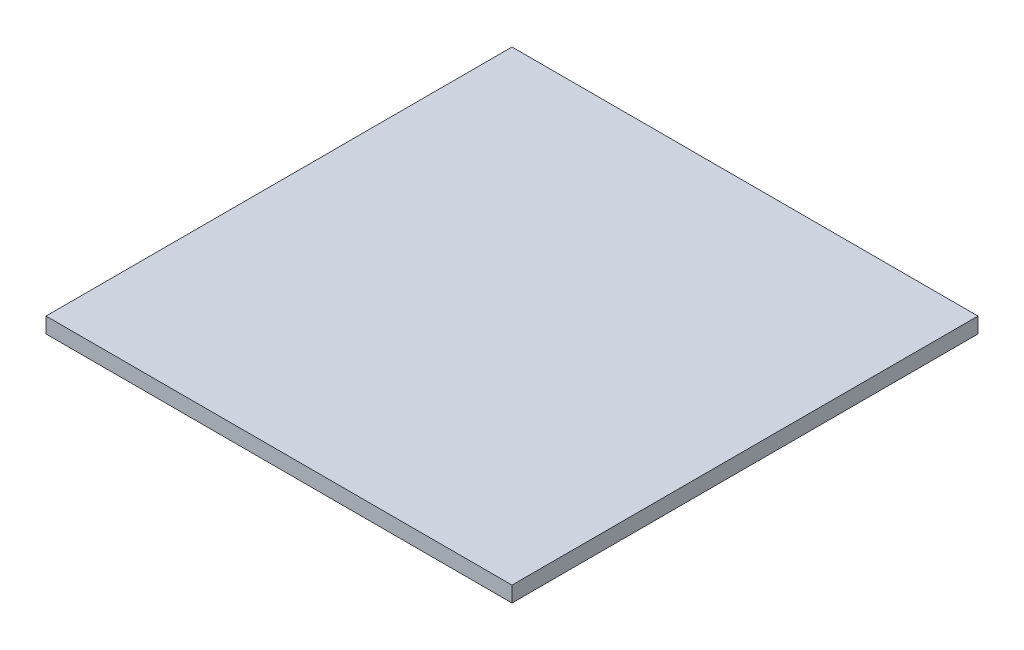
from build123d import *

# Parameters (mm, degrees)
ESBO_O1_W                = 300
ESBO_O1_H                = 300
RESSALTO_EXTRUS_O1_DEPTH = 10


with BuildPart() as part:
    # Esboço1 → Ressalto-extrusão1 (new body)
    with BuildSketch(Plane(origin=(0, 0, 0), x_dir=(1, 0, 0), z_dir=(0, 1, 0))):
        with Locations((150, 150)):
            Rectangle(ESBO_O1_W, ESBO_O1_H)
    extrude(amount=RESSALTO_EXTRUS_O1_DEPTH)


solid = part.part
